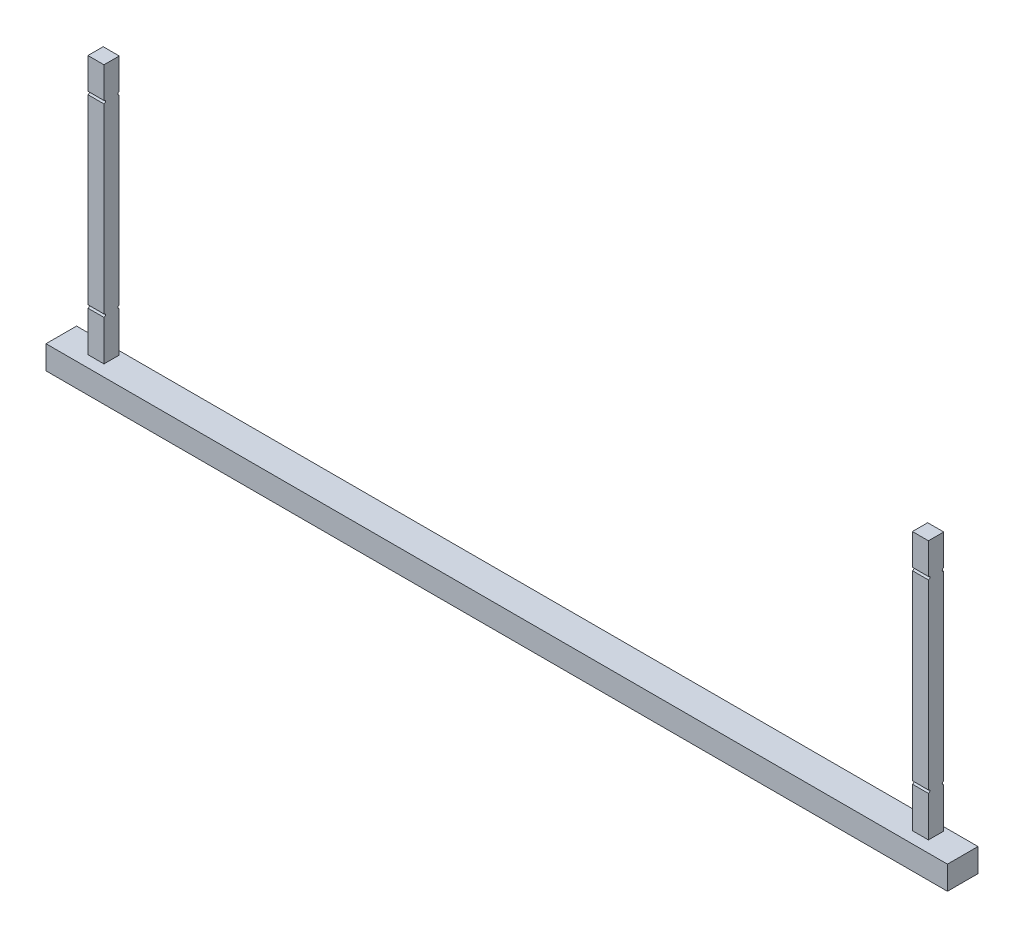
from build123d import *

# Parameters (mm, degrees)
ESBO_O1_W                                = 5900
ESBO_O1_H                                = 154
RESSALTO_EXTRUS_O1_DEPTH                 = 200
ESBO_O3_W                                = 105
ESBO_O3_H                                = 100
RESSALTO_EXTRUS_O2_DEPTH                 = 1849.72
BROCA_DE_ROSQUEAR_PARA_TARRAXA_DE_M222_D = 19.5
BROCA_DE_ROSQUEAR_PARA_TARRAXA_DE_M223_D = 19.5


with BuildPart() as part:
    # Esboço1 → Ressalto-extrusão1 (new body)
    with BuildSketch(Plane.XY):
        with Locations((2950, 77)):
            Rectangle(ESBO_O1_W, ESBO_O1_H)
    extrude(amount=RESSALTO_EXTRUS_O1_DEPTH)

    # Esboço3 → Ressalto-extrusão2 (add)
    with BuildSketch(Plane(origin=(0, 0, 0), x_dir=(1, 0, 0), z_dir=(0, 1, 0))):
        with Locations((5648.13, -75)):
            Rectangle(ESBO_O3_W, ESBO_O3_H)
        with Locations((251.876102892, -75)):
            Rectangle(ESBO_O3_W, ESBO_O3_H)
    extrude(amount=RESSALTO_EXTRUS_O2_DEPTH)

    # Broca de rosquear para tarraxa de M222 (through all)
    with Locations(Plane(origin=(5700.63, 0, 0), x_dir=(0, 0, -1), z_dir=(1, 0, 0))):
        with Locations((-125, 427.54), (-25, 427.54)):
            Hole(BROCA_DE_ROSQUEAR_PARA_TARRAXA_DE_M222_D / 2)

    # Broca de rosquear para tarraxa de M223 (through all)
    with Locations(Plane(origin=(5700.63, 0, 0), x_dir=(0, 0, -1), z_dir=(1, 0, 0))):
        with Locations((-125, 1637.54), (-25, 1637.54)):
            Hole(BROCA_DE_ROSQUEAR_PARA_TARRAXA_DE_M223_D / 2)


solid = part.part
